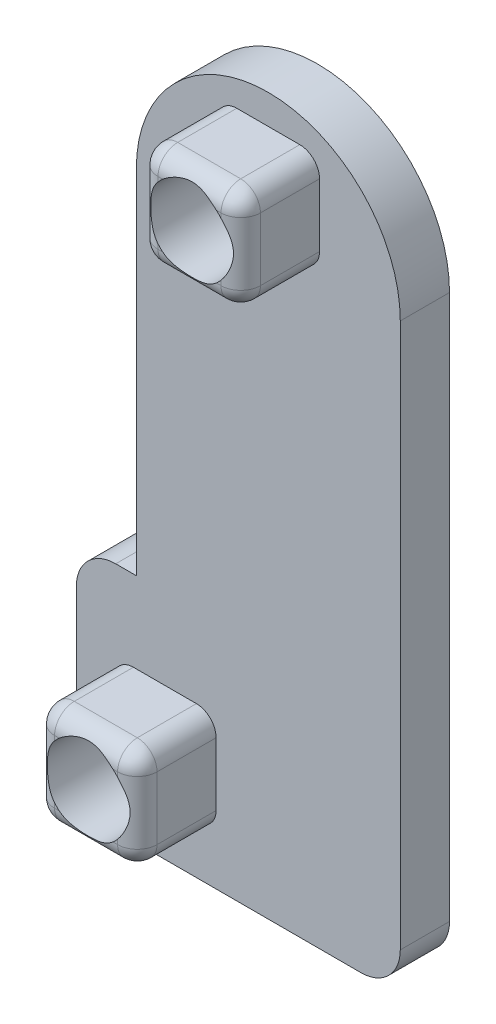
from build123d import *

# Parameters (mm, degrees)
BOSS_EXTRUDE1_DEPTH = 2.5
SKETCH1_3_W         = 5.2
SKETCH1_3_H         = 5.2
BOSS_EXTRUDE2_DEPTH = 6.5
FILLET1_R           = 2
FILLET2_R           = 1
SKETCH2_R           = 2.1
CUT_EXTRUDE1_DEPTH  = 7.5


with BuildPart() as part:
    # Sketch1 → Boss-Extrude1 (new body)
    with BuildSketch(Plane(origin=(0, 0, 0), x_dir=(0, 1, 0), z_dir=(0, 0, 1))):
        with BuildLine():
            Line((-7.649421348, 9.749384529), (-7.649421348, 4.119353309))
            Line((-7.649421348, 4.119353309), (-7.652407104, -3.880646133))
            Line((-7.652407104, -3.880646133), (-7.652407104, -6.7))
            Line((-7.652407104, -6.7), (22, -6.7))
            ThreePointArc((22, -6.7), (28.7, 0), (22, 6.7))
            Line((22, 6.7), (4.1, 6.7))
            Line((4.1, 6.7), (4.1, 9.744999415))
            Line((4.1, 9.744999415), (-7.649421348, 9.749384529))
        make_face()
    extrude(amount=BOSS_EXTRUDE1_DEPTH)

    # Sketch1<3> → Boss-Extrude2 (add)
    with BuildSketch(Plane(origin=(0, 0, 0), x_dir=(0, 1, 0), z_dir=(0, 0, 1))):
        with Locations((24.6, 0)):
            Rectangle(SKETCH1_3_W, SKETCH1_3_H)
        with Locations((-2.6, 5.25)):
            Rectangle(SKETCH1_3_W, SKETCH1_3_H)
    extrude(amount=BOSS_EXTRUDE2_DEPTH)

    # Fillet1
    fillet1_edges = [part.edges().sort_by_distance(p)[0] for p in [
        (-9.744999415, 4.1, 1.25),
        (-9.749384529, -7.649421348, 1.25),
        (6.7, -7.652407104, 1.25),
    ]]
    fillet(fillet1_edges, radius=FILLET1_R)

    # Fillet2
    fillet2_edges = [part.edges().sort_by_distance(p)[0] for p in [
        (0, 22, 6.5),
        (-2.6, 24.6, 6.5),
        (0, 27.2, 6.5),
        (2.6, 24.6, 6.5),
        (-5.25, -5.2, 6.5),
        (-7.85, -2.6, 6.5),
        (-5.25, 0, 6.5),
        (-2.65, -2.6, 6.5),
        (-2.6, 27.2, 4.5),
        (2.6, 27.2, 4.5),
        (2.6, 22, 4.5),
        (-2.6, 22, 4.5),
        (-7.85, -5.2, 4.5),
        (-7.85, 0, 4.5),
        (-2.65, 0, 4.5),
        (-2.65, -5.2, 4.5),
    ]]
    fillet(fillet2_edges, radius=FILLET2_R)

    # Sketch2 → Cut-Extrude1 (cut)
    with BuildSketch(Plane.XY.offset(6.5)):
        with Locations((-5.25, -2.6)):
            Circle(SKETCH2_R)
        with Locations((0, 24.6)):
            Circle(SKETCH2_R)
    extrude(amount=-CUT_EXTRUDE1_DEPTH, mode=Mode.SUBTRACT)


solid = part.part
